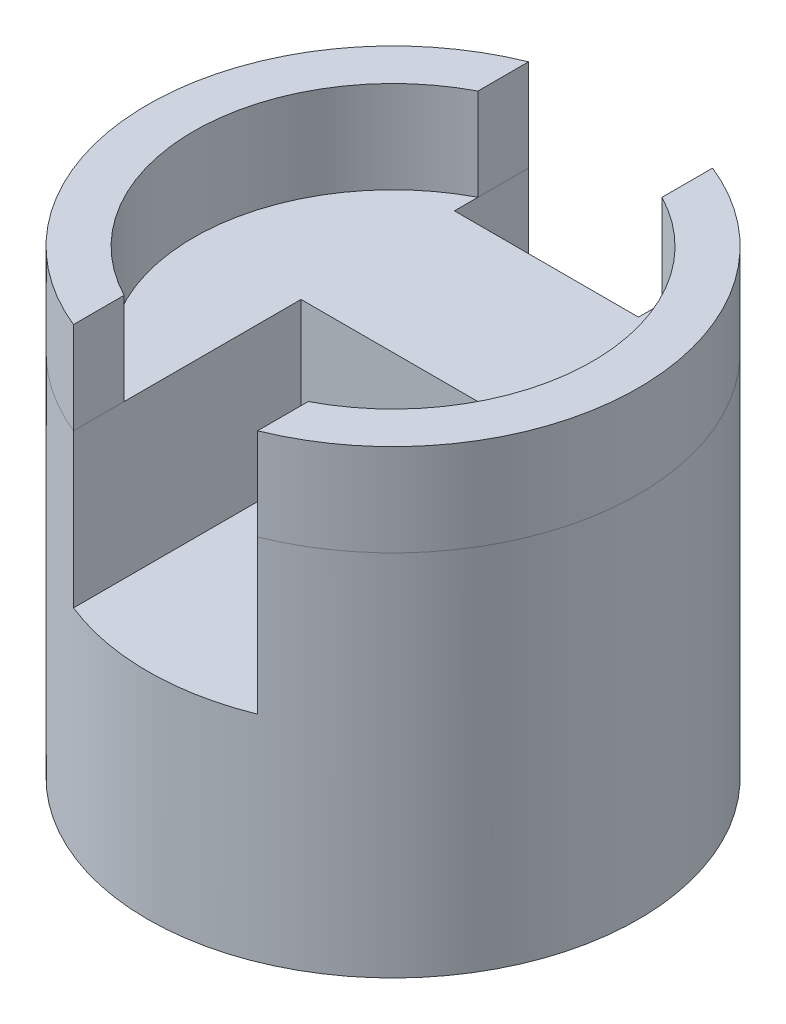
from build123d import *

# Parameters (mm, degrees)
SKETCH2_R           = 101.6
BOSS_EXTRUDE1_DEPTH = 152.4
SKETCH3_R           = 101.6
SKETCH3_R_2         = 82.55
BOSS_EXTRUDE2_DEPTH = 38.1
SKETCH4_W           = 76.2
SKETCH4_H           = 101.6
CUT_EXTRUDE1_DEPTH  = 101.6
SKETCH5_W           = 76.2
SKETCH5_H           = 38.1
CUT_EXTRUDE2_DEPTH  = 239.611336696


with BuildPart() as part:
    # Sketch2 → Boss-Extrude1 (new body)
    with BuildSketch(Plane(origin=(0, 0, 0), x_dir=(1, 0, 0), z_dir=(0, 1, 0))):
        with Locations(Location((0, 0, 0), (0, 0, 90))):
            Circle(SKETCH2_R)
    extrude(amount=BOSS_EXTRUDE1_DEPTH)


with BuildPart() as body_2:
    # Sketch3 → Boss-Extrude2 (new body)
    with BuildSketch(Plane(origin=(0, 152.4, 0), x_dir=(1, 0, 0), z_dir=(0, 1, 0))):
        with Locations(Location((0, 0, 0), (0, 0, 90))):
            Circle(SKETCH3_R)
        with Locations(Location((0, 0, 0), (0, 0, 90))):
            Circle(SKETCH3_R_2, mode=Mode.SUBTRACT)
    extrude(amount=BOSS_EXTRUDE2_DEPTH)


with BuildPart() as cut_extrude1_tool:
    # Sketch4 → Cut-Extrude1 (new body)
    with BuildSketch(Plane(origin=(0, 190.5, 0), x_dir=(1, 0, 0), z_dir=(0, 1, 0))):
        with Locations((0, -50.8)):
            Rectangle(SKETCH4_W, SKETCH4_H)
    extrude(amount=-CUT_EXTRUDE1_DEPTH)


with BuildPart() as part_1:
    add(part.part)

    # Cut-Extrude1: cut by cut_extrude1_tool
    add(cut_extrude1_tool.part, mode=Mode.SUBTRACT)


with BuildPart() as body_2_1:
    add(body_2.part)

    # Cut-Extrude1: cut by cut_extrude1_tool
    add(cut_extrude1_tool.part, mode=Mode.SUBTRACT)


with BuildPart() as cut_extrude2_tool:
    # Sketch5 → Cut-Extrude2 (new, through all)
    with BuildSketch(Plane(origin=(0, 190.5, 0), x_dir=(1, 0, 0), z_dir=(0, 1, 0))):
        with Locations((0, 82.55)):
            Rectangle(SKETCH5_W, SKETCH5_H)
    extrude(amount=-CUT_EXTRUDE2_DEPTH)


with BuildPart() as part_2:
    add(part_1.part)

    # Cut-Extrude2: cut by cut_extrude2_tool
    add(cut_extrude2_tool.part, mode=Mode.SUBTRACT)


with BuildPart() as body_2_2:
    add(body_2_1.part)

    # Cut-Extrude2: cut by cut_extrude2_tool
    add(cut_extrude2_tool.part, mode=Mode.SUBTRACT)


solid = Compound([part_2.part, body_2_2.part])
